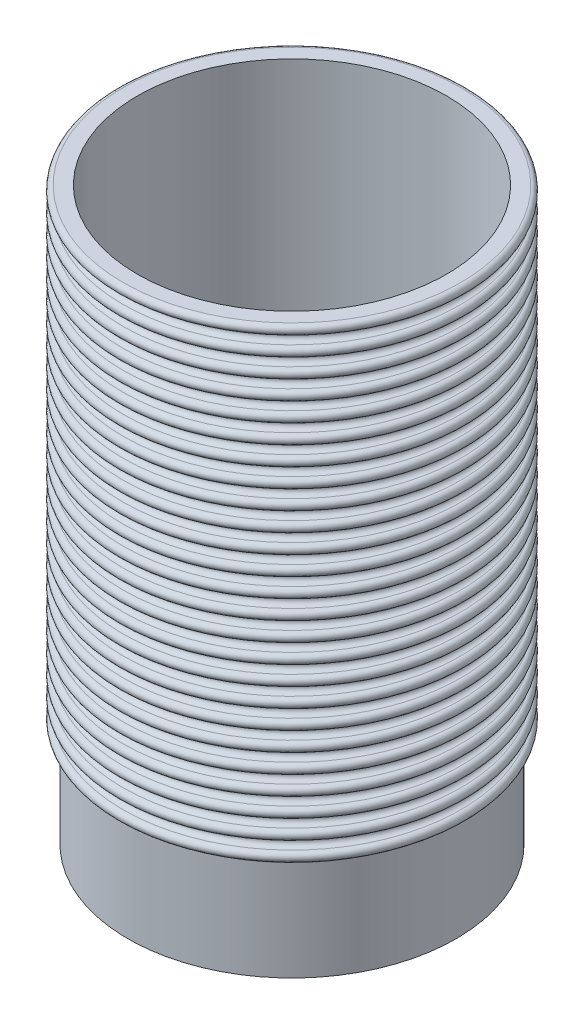
from build123d import *

# Parameters (mm, degrees)
SKETCH1_R           = 54.76875
SKETCH1_R_2         = 51.59375
BOSS_EXTRUDE1_DEPTH = 190.5
LPATTERN1_COUNT     = 24
LPATTERN1_PITCH     = 6.35


with BuildPart() as part:
    # Sketch1 → Boss-Extrude1 (new body)
    with BuildSketch(Plane(origin=(0, 0, 0), x_dir=(1, 0, 0), z_dir=(0, 1, 0))):
        with Locations(Location((0, 0, 0), (0, 0, 270))):
            Circle(SKETCH1_R)
        with Locations(Location((0, 0, 0), (0, 0, 270))):
            Circle(SKETCH1_R_2, mode=Mode.SUBTRACT)
    extrude(amount=BOSS_EXTRUDE1_DEPTH)

    # Sketch2 → Revolve1 (revolve)
    with BuildSketch(Plane.XY, mode=Mode.PRIVATE) as revolve1_sk:
        with BuildLine():
            Line((-54.76875, 185.7375), (-54.76875, 190.5))
            Line((-54.76875, 190.5), (-56.35625, 190.5))
            ThreePointArc((-56.35625, 190.5), (-57.94375, 188.9125), (-56.35625, 187.325))
            ThreePointArc((-56.35625, 187.325), (-55.233717985, 186.860032015), (-54.76875, 185.7375))
        make_face()
        with BuildLine():
            Line((-54.76875, 184.15), (-54.76875, 185.7375))
            ThreePointArc((-54.76875, 185.7375), (-55.233717985, 184.614967985), (-56.35625, 184.15))
            Line((-56.35625, 184.15), (-54.76875, 184.15))
        make_face()
    revolve1 = revolve(revolve1_sk.sketch.rotate(Axis((0, 0, 0), (0, 1, 0)), 270), axis=Axis((0, 0, 0), (0, 1, 0)))

    # LPattern1: Revolve1 ×24
    with Locations(*[(0, -i * LPATTERN1_PITCH, 0) for i in range(1, LPATTERN1_COUNT)]):
        add(revolve1)

    # Sketch3 → Revolve2 (revolve)
    with BuildSketch(Plane.XY, mode=Mode.PRIVATE) as revolve2_sk:
        with BuildLine():
            ThreePointArc((-56.35625, 38.1), (-57.94375, 36.5125), (-56.35625, 34.925))
            ThreePointArc((-56.35625, 34.925), (-55.233717985, 34.460032015), (-54.76875, 33.3375))
            Line((-54.76875, 33.3375), (-54.76875, 38.1))
            Line((-54.76875, 38.1), (-56.35625, 38.1))
        make_face()
    revolve(revolve2_sk.sketch.rotate(Axis((0, 0, 0), (0, 1, 0)), 270), axis=Axis((0, 0, 0), (0, 1, 0)))


solid = part.part
